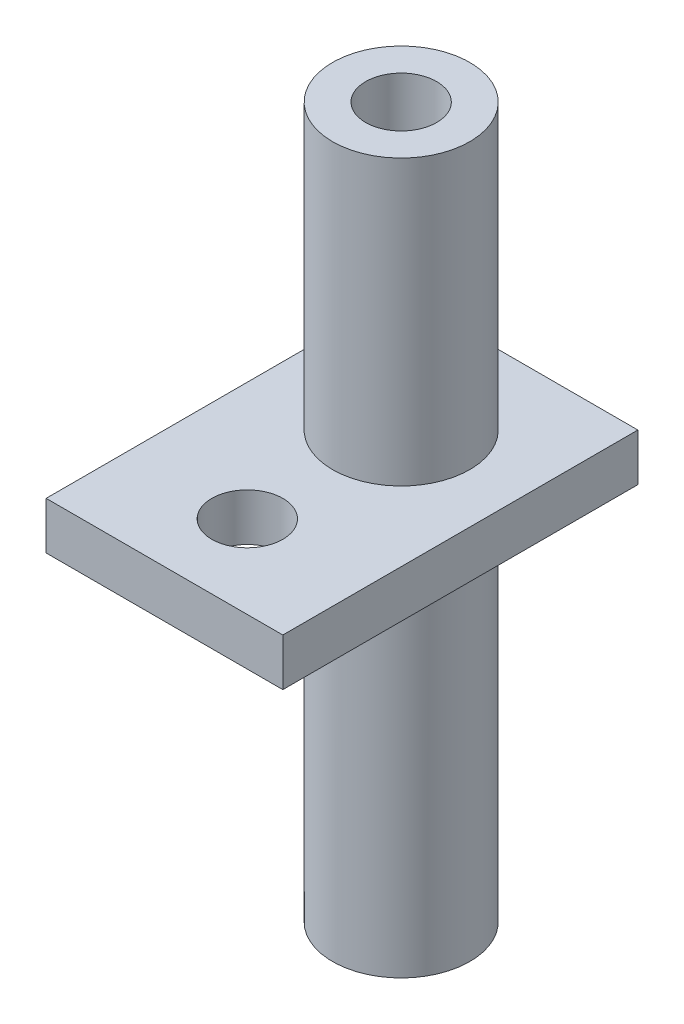
from build123d import *

# Parameters (mm, degrees)
SKETCH_1_R          = 2.9
SKETCH_1_R_2        = 1.5
EXTRUDE_1_DEPTH     = 40
SKETCH_2_W          = 10
SKETCH_2_H          = 15
SKETCH_2_R          = 1.5
EXTRUDE_2_DEPTH     = 2
SKETCH_3_R          = 2.9
CUT_EXTRUDE_1_DEPTH = 33.015621187


with BuildPart() as part:
    # 草图1 → 凸台-拉伸1 (new body)
    with BuildSketch(Plane(origin=(0, 0, 0), x_dir=(1, 0, 0), z_dir=(0, 1, 0))):
        with Locations(Location((0, 0, 0), (0, 0, 270))):
            Circle(SKETCH_1_R)
        with Locations(Location((0, 0, 0), (0, 0, 270))):
            Circle(SKETCH_1_R_2, mode=Mode.SUBTRACT)
    extrude(amount=EXTRUDE_1_DEPTH)

    # 草图2 → 凸台-拉伸2 (add)
    with BuildSketch(Plane(origin=(0, 28, 0), x_dir=(1, 0, 0), z_dir=(0, 1, 0))):
        with Locations((0, -2.5)):
            Rectangle(SKETCH_2_W, SKETCH_2_H)
        with Locations(Location((0, -6.5, 0), (0, 0, 270))):
            Circle(SKETCH_2_R, mode=Mode.SUBTRACT)
    extrude(amount=-EXTRUDE_2_DEPTH)

    # 草图3 → 切除-拉伸1 (cut, through all)
    with BuildSketch(Plane(origin=(0, 10, 0), x_dir=(-1, 0, 0), z_dir=(0, -1, 0))):
        with Locations(Location((0, 0, 0), (0, 0, 90))):
            Circle(SKETCH_3_R)
    extrude(amount=CUT_EXTRUDE_1_DEPTH, mode=Mode.SUBTRACT)


solid = part.part
